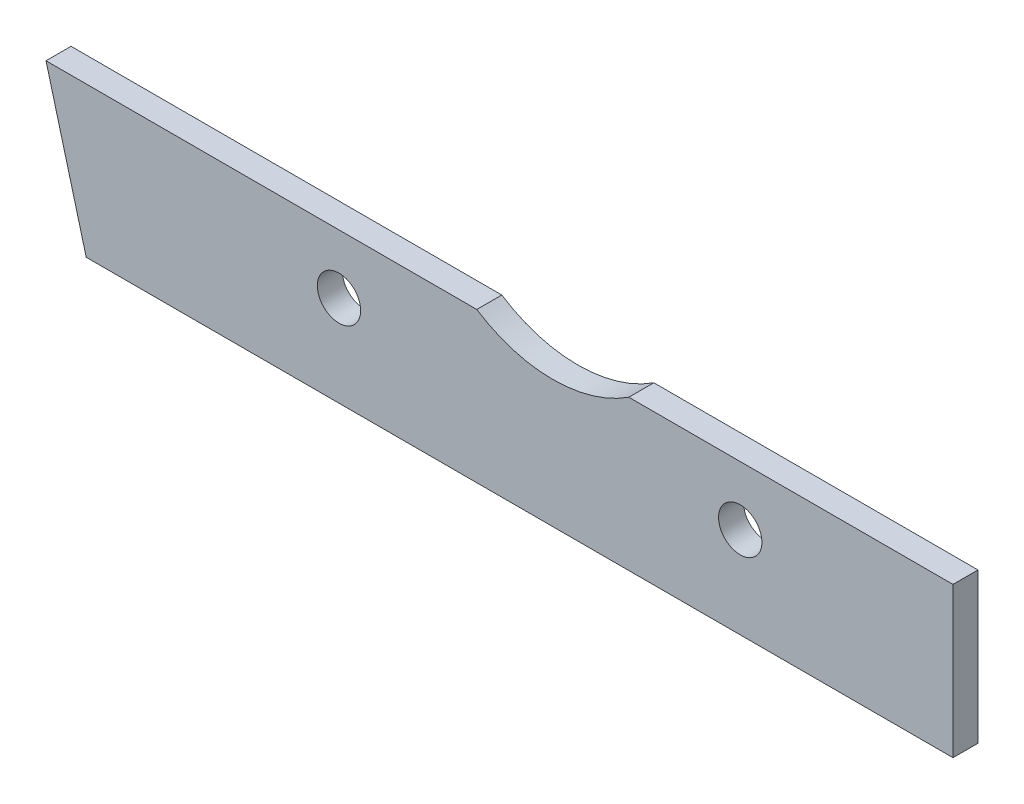
from build123d import *

# Parameters (mm, degrees)
SKETCH1_R           = 2.75
BOSS_EXTRUDE1_DEPTH = 3.175


with BuildPart() as part:
    # Sketch1 → Boss-Extrude1 (new body)
    with BuildSketch(Plane.XY):
        with BuildLine():
            Line((-94.828483368, -355.15), (-204.828483368, -355.15))
            Line((-204.828483368, -355.15), (-209.932915484, -336.1))
            Line((-209.932915484, -336.1), (-155.261017178, -336.1))
            ThreePointArc((-155.261017178, -336.1), (-145.615191064, -338.971618374), (-135.96936495, -336.1))
            Line((-135.96936495, -336.1), (-94.828483368, -336.1))
            Line((-94.828483368, -336.1), (-94.828483368, -355.15))
        make_face()
        with Locations((-121.828483368, -343.6)):
            Circle(SKETCH1_R, mode=Mode.SUBTRACT)
        with Locations((-172.748438952, -343.6)):
            Circle(SKETCH1_R, mode=Mode.SUBTRACT)
    extrude(amount=-BOSS_EXTRUDE1_DEPTH)


solid = part.part
